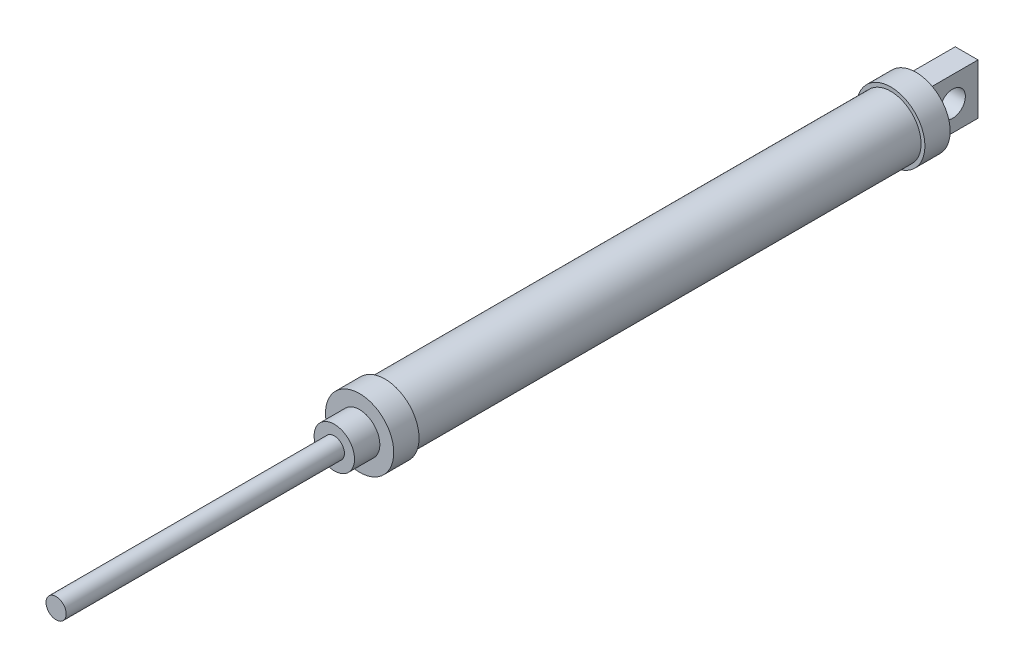
from build123d import *

# Parameters (mm, degrees)
SKETCH1_R           = 13.5
BOSS_EXTRUDE1_DEPTH = 10
SKETCH2_R           = 8
BOSS_EXTRUDE2_DEPTH = 10
SKETCH3_R           = 12
BOSS_EXTRUDE3_DEPTH = 200
BOSS_EXTRUDE4_START = 10
SKETCH4_R           = 13.5
BOSS_EXTRUDE4_DEPTH = 10
SKETCH5_W           = 9
SKETCH5_H           = 20
BOSS_EXTRUDE5_DEPTH = 20
SKETCH6_R           = 5
CUT_EXTRUDE1_DEPTH  = 20
SKETCH8_R           = 4
BOSS_EXTRUDE6_DEPTH = 110


with BuildPart() as part:
    # Sketch1 → Boss-Extrude1 (new body)
    with BuildSketch(Plane.XY):
        Circle(SKETCH1_R)
    extrude(amount=BOSS_EXTRUDE1_DEPTH)

    # Sketch2 → Boss-Extrude2 (add)
    with BuildSketch(Plane.XY.offset(10)):
        Circle(SKETCH2_R)
    extrude(amount=BOSS_EXTRUDE2_DEPTH)

    # Sketch3 → Boss-Extrude3 (add)
    with BuildSketch(Plane(origin=(0, 0, 0), x_dir=(-1, 0, 0), z_dir=(0, 0, -1))):
        Circle(SKETCH3_R)
    extrude(amount=BOSS_EXTRUDE3_DEPTH)

    # Sketch4 → Boss-Extrude4 (add)
    with BuildSketch(Plane(origin=(0, 0, -200), x_dir=(-1, 0, 0), z_dir=(0, 0, -1)).offset(BOSS_EXTRUDE4_START)):
        with Locations(Location((0, 0, 0), (0, 0, 180))):
            Circle(SKETCH4_R)
    extrude(amount=-BOSS_EXTRUDE4_DEPTH)

    # Sketch5 → Boss-Extrude5 (add)
    with BuildSketch(Plane(origin=(0, 0, -210), x_dir=(-1, 0, 0), z_dir=(0, 0, -1))):
        Rectangle(SKETCH5_W, SKETCH5_H)
    extrude(amount=BOSS_EXTRUDE5_DEPTH)

    # Sketch6 → Cut-Extrude1 (cut)
    with BuildSketch(Plane(origin=(4.5, 0, 0), x_dir=(0, 0, -1), z_dir=(1, 0, 0))):
        with Locations(Location((220, 0, 0), (0, 0, 90))):
            Circle(SKETCH6_R)
    extrude(amount=-CUT_EXTRUDE1_DEPTH, mode=Mode.SUBTRACT)

    # Sketch8 → Boss-Extrude6 (add)
    with BuildSketch(Plane.XY.offset(20)):
        Circle(SKETCH8_R)
    extrude(amount=BOSS_EXTRUDE6_DEPTH)


solid = part.part
